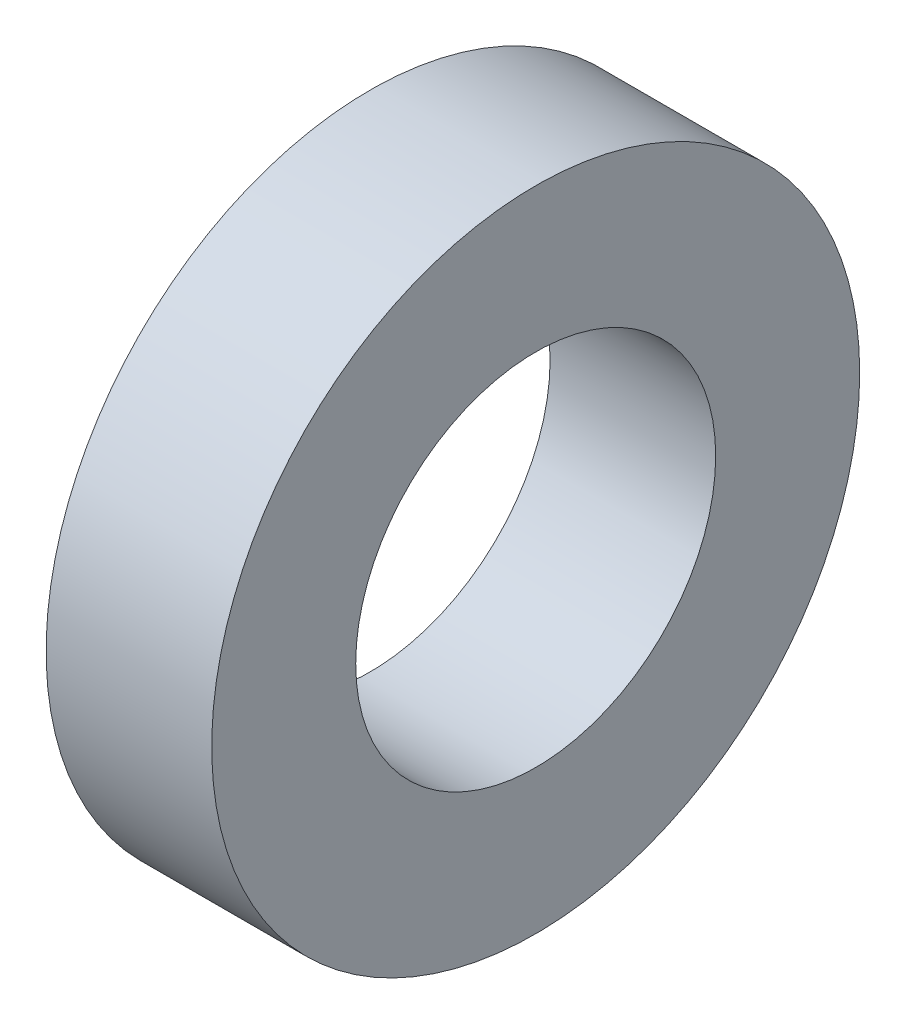
from build123d import *

# Parameters (mm, degrees)
SKETCH_1_W = 23
SKETCH_1_H = 20


with BuildPart() as part:
    # Эскиз1 → Повернуть1 (revolve)
    with BuildSketch(Plane.XY, mode=Mode.PRIVATE) as revolve_1_sk:
        with Locations((0, 35)):
            Rectangle(SKETCH_1_W, SKETCH_1_H)
    revolve(revolve_1_sk.sketch.rotate(Axis((0, 0, 0), (-1, 0, 0)), 90), axis=Axis((0, 0, 0), (-1, 0, 0)))


solid = part.part
